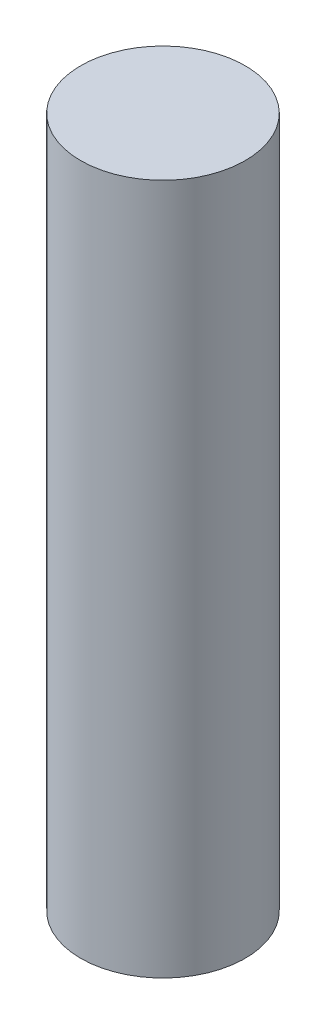
from build123d import *

# Parameters (mm, degrees)
SKETCH1_R           = 4.7625
BOSS_EXTRUDE1_DEPTH = 40


with BuildPart() as part:
    # Sketch1 → Boss-Extrude1 (new body)
    with BuildSketch(Plane(origin=(0, 0, 0), x_dir=(1, 0, 0), z_dir=(0, 1, 0))):
        with Locations(Location((0, 0, 0), (0, 0, 270))):
            Circle(SKETCH1_R)
    extrude(amount=BOSS_EXTRUDE1_DEPTH)


solid = part.part
